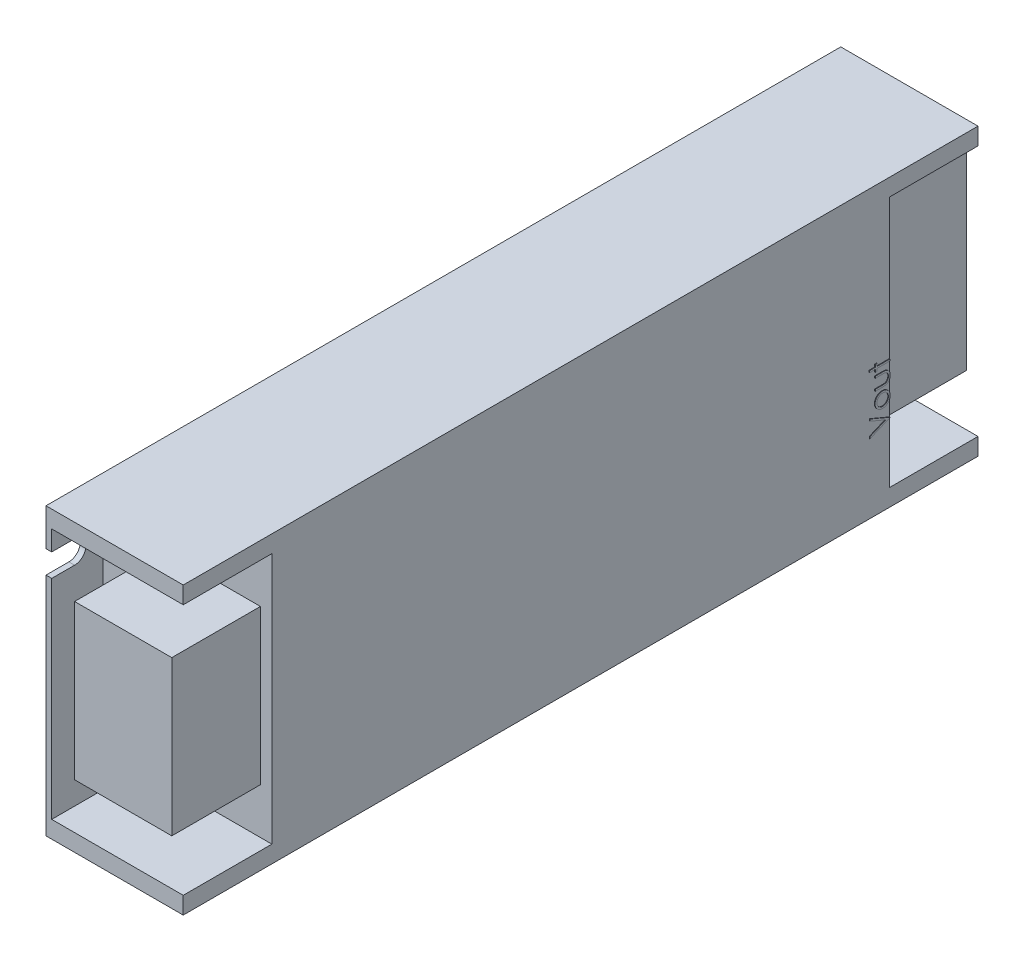
from build123d import *

# Parameters (mm, degrees)
SKICA1_W                 = 24
SKICA1_H                 = 50
P_IDAT_VYSUNUT_M1_DEPTH  = 139
SKICA2_W                 = 15.5
SKICA2_H                 = 44
ODEBRAT_VYSUNUT_M1_DEPTH = 19
SKICA4_W                 = 9
SKICA4_H                 = 44
ODEBRAT_VYSUNUT_M2_DEPTH = 4
SKICA5_W                 = 15.5
SKICA5_H                 = 27
SKICA5_H_2               = 35
P_IDAT_VYSUNUT_M2_DEPTH  = 17
P_IDAT_VYSUNUT_M3_DEPTH  = 0.1
ODEBRAT_VYSUNUT_M3_DEPTH = 10


with BuildPart() as part:
    # Skica1 → Přidat vysunutím1 (new body)
    with BuildSketch(Plane.XY):
        with Locations((12, 25)):
            Rectangle(SKICA1_W, SKICA1_H)
    extrude(amount=P_IDAT_VYSUNUT_M1_DEPTH)

    # Skica2 → Odebrat vysunutím1 (cut)
    with BuildSketch(Plane(origin=(24, 0, 0), x_dir=(0, 0, -1), z_dir=(1, 0, 0))):
        with Locations((-131.25, 25)):
            Rectangle(SKICA2_W, SKICA2_H)
        with Locations((-7.75, 25)):
            Rectangle(SKICA2_W, SKICA2_H)
    extrude(amount=-ODEBRAT_VYSUNUT_M1_DEPTH, mode=Mode.SUBTRACT)

    # Skica4 → Odebrat vysunutím2 (cut)
    with BuildSketch(Plane(origin=(5, 0, 0), x_dir=(0, 0, -1), z_dir=(1, 0, 0))):
        with Locations((-134.5, 25)):
            Rectangle(SKICA4_W, SKICA4_H)
        with Locations((-4.5, 25)):
            Rectangle(SKICA4_W, SKICA4_H)
    extrude(amount=-ODEBRAT_VYSUNUT_M2_DEPTH, mode=Mode.SUBTRACT)

    # Skica5 → Přidat vysunutím2 (add)
    with BuildSketch(Plane(origin=(5, 0, 0), x_dir=(0, 0, -1), z_dir=(1, 0, 0))):
        with Locations((-131.25, 24.5)):
            Rectangle(SKICA5_W, SKICA5_H)
        with Locations((-7.75, 29.5)):
            Rectangle(SKICA5_W, SKICA5_H_2)
    extrude(amount=P_IDAT_VYSUNUT_M2_DEPTH)

    # Skica6 → Přidat vysunutím3 (add)
    # profile 1 of 4: a face of its own
    with BuildSketch(Plane(origin=(24, 0, 0), x_dir=(0, 0, -1), z_dir=(1, 0, 0))):
        Polygon((-19, 12.179487179), (-19, 12.516025641), (-16.241786859, 13.682692308), (-19, 14.849358974), (-19, 15.185897436), (-15.5, 13.705128205), (-15.5, 13.66025641), align=None)
    # profile 2 of 4: a face of its own
    with BuildSketch(Plane(origin=(24, 0, 0), x_dir=(0, 0, -1), z_dir=(1, 0, 0))):
        with BuildLine():
            add(Edge.make_bspline(
                [(-18.102564103, 17.004607372), (-18.101542211, 17.052598645), (-18.099538533, 17.146697802), (-18.078123567, 17.284505688), (-18.045376203, 17.416050824), (-18.000104641, 17.541837016), (-17.93942269, 17.660253312), (-17.867013399, 17.773024556), (-17.781230805, 17.879841565), (-17.714872737, 17.943864594), (-17.681189904, 17.976362179)],
                knots=[0, 0, 0, 0, 1.054011418, 2.066658804, 3.057071809, 4.030435133, 4.997543892, 5.974964718, 6.972108034, 8, 8, 8, 8], degree=3))
            add(Edge.make_bspline(
                [(-17.681189904, 17.976362179), (-17.648975918, 18.004344134), (-17.585171376, 18.059766514), (-17.481715763, 18.130832233), (-17.374575662, 18.192053793), (-17.262328336, 18.241116754), (-17.145953664, 18.279801777), (-17.025051653, 18.307267474), (-16.899889306, 18.323604409), (-16.814885468, 18.325807376), (-16.771834936, 18.326923077)],
                knots=[0, 0, 0, 0, 1.025258237, 2.030674902, 3.01204498, 3.988269485, 4.97094183, 5.956517959, 6.965070386, 8, 8, 8, 8], degree=3))
            add(Edge.make_bspline(
                [(-16.771834936, 18.326923077), (-16.728534878, 18.32594174), (-16.642971945, 18.324002571), (-16.516952579, 18.305658955), (-16.394757756, 18.277127869), (-16.276899063, 18.236296031), (-16.163016235, 18.183937922), (-16.053606686, 18.120047234), (-15.948454553, 18.044175617), (-15.848452714, 17.95817162), (-15.7562865, 17.863119744), (-15.67595823, 17.760003596), (-15.607136706, 17.650849562), (-15.55170029, 17.534206209), (-15.50799059, 17.411138722), (-15.477290573, 17.281381654), (-15.45872889, 17.145136583), (-15.456345316, 17.052109362), (-15.455128205, 17.004607372)],
                knots=[0, 0, 0, 0, 0.998656419, 1.973391657, 2.932242238, 3.890759089, 4.846373663, 5.82037756, 6.809684879, 7.83454468, 8.860553229, 9.859544525, 10.845671541, 11.83227036, 12.833544569, 13.85385346, 14.904124723, 16, 16, 16, 16], degree=3))
            add(Edge.make_bspline(
                [(-15.455128205, 17.004607372), (-15.456349401, 16.956872652), (-15.458741176, 16.863381793), (-15.477218459, 16.726655811), (-15.507976441, 16.596666192), (-15.551843934, 16.473437593), (-15.607138478, 16.356292746), (-15.675750167, 16.246506249), (-15.756310322, 16.143306334), (-15.848446259, 16.048234349), (-15.948456216, 15.962235744), (-16.053606254, 15.886362736), (-16.163016348, 15.82247241), (-16.276899033, 15.770114206), (-16.394757764, 15.729282393), (-16.516952577, 15.7007513), (-16.642971945, 15.682407685), (-16.728534878, 15.680468517), (-16.771834936, 15.679487179)],
                knots=[0, 0, 0, 0, 1.099876186, 2.154163076, 3.173186993, 4.173200201, 5.163417411, 6.152872554, 7.150605724, 8.17532212, 9.198891216, 10.186952605, 11.159729845, 12.11414092, 13.071450619, 14.029093627, 15.002601286, 16, 16, 16, 16], degree=3))
            add(Edge.make_bspline(
                [(-16.771834936, 15.679487179), (-16.814652437, 15.680607821), (-16.899423731, 15.682826499), (-17.02433693, 15.699185729), (-17.144868911, 15.726352577), (-17.260608083, 15.765573886), (-17.372585626, 15.814545771), (-17.48011856, 15.875151162), (-17.583122115, 15.946904323), (-17.646842045, 16.002111388), (-17.679086538, 16.030048077)],
                knots=[0, 0, 0, 0, 1.031377469, 2.041950136, 3.029500481, 4.003457997, 4.981637986, 5.969878303, 6.97268806, 8, 8, 8, 8], degree=3))
            add(Edge.make_bspline(
                [(-17.679086538, 16.030048077), (-17.713061478, 16.062496668), (-17.779879174, 16.126312532), (-17.865411698, 16.23366126), (-17.939327772, 16.346155081), (-17.998803987, 16.465880007), (-18.045642505, 16.591562865), (-18.07820802, 16.723782107), (-18.099461375, 16.862057623), (-18.101519553, 16.956617244), (-18.102564103, 17.004607372)],
                knots=[0, 0, 0, 0, 1.027980169, 2.021703884, 2.998553061, 3.971491411, 4.943284454, 5.930300938, 6.949603206, 8, 8, 8, 8], degree=3))
        make_face()
        with BuildLine():
            add(Edge.make_bspline(
                [(-17.788461538, 17.003205128), (-17.787496947, 16.969267517), (-17.785592664, 16.902268388), (-17.771108759, 16.803648804), (-17.748161257, 16.708708647), (-17.715557194, 16.617267816), (-17.673458319, 16.529634591), (-17.621749868, 16.445725389), (-17.561117263, 16.365292174), (-17.49165323, 16.289913113), (-17.415779287, 16.22071966), (-17.334912684, 16.160281923), (-17.250292131, 16.108601148), (-17.16179029, 16.066329343), (-17.069105401, 16.03390987), (-16.97278329, 16.010936816), (-16.872533096, 15.99642639), (-16.804369985, 15.994545536), (-16.769731571, 15.993589744)],
                knots=[0, 0, 0, 0, 1.02155314, 2.01673505, 2.994700672, 3.958461264, 4.934171024, 5.916582427, 6.921469794, 7.962398674, 8.998583302, 10.009097305, 10.997513862, 11.97957236, 12.956600784, 13.948243505, 14.957359924, 16, 16, 16, 16], degree=3))
            add(Edge.make_bspline(
                [(-16.769731571, 15.993589744), (-16.724979543, 15.995196567), (-16.636155138, 15.998385812), (-16.505344015, 16.024321048), (-16.379762163, 16.067707328), (-16.260145777, 16.126294608), (-16.149473499, 16.199700826), (-16.050802015, 16.286187893), (-15.965616203, 16.384827593), (-15.894935358, 16.494444094), (-15.838775602, 16.612798412), (-15.798976626, 16.738054733), (-15.773104934, 16.868695427), (-15.770533459, 16.957976158), (-15.769230769, 17.003205128)],
                knots=[0, 0, 0, 0, 1.016792936, 2.018143844, 3.017858371, 4.030088057, 5.03801393, 6.028138512, 7.003788237, 7.991172063, 8.984598303, 9.972568034, 10.972917682, 12, 12, 12, 12], degree=3))
            add(Edge.make_bspline(
                [(-15.769230769, 17.003205128), (-15.770541049, 17.048431497), (-15.773127506, 17.137707093), (-15.798846326, 17.26816627), (-15.838949987, 17.393080242), (-15.894872197, 17.511311629), (-15.965884611, 17.620878233), (-16.050320988, 17.720227354), (-16.14973484, 17.805975965), (-16.260292369, 17.87930957), (-16.379576721, 17.938856313), (-16.505367193, 17.982039515), (-16.636149235, 18.008037101), (-16.724977566, 18.011217929), (-16.769731571, 18.012820513)],
                knots=[0, 0, 0, 0, 1.02726834, 2.027799167, 3.010890988, 4.004497153, 4.992059811, 5.971914811, 6.958719428, 7.966827853, 8.981595046, 9.981490638, 10.983022906, 12, 12, 12, 12], degree=3))
            add(Edge.make_bspline(
                [(-16.769731571, 18.012820513), (-16.804370192, 18.01186505), (-16.87253371, 18.009984845), (-16.972780943, 17.9954697), (-17.069113987, 17.972514072), (-17.161758671, 17.940030517), (-17.250521749, 17.897946481), (-17.334664636, 17.845272203), (-17.416059349, 17.785081319), (-17.491407949, 17.71505306), (-17.56114434, 17.639752675), (-17.62177338, 17.559286865), (-17.673231066, 17.475502086), (-17.715917283, 17.388123451), (-17.747864629, 17.296670897), (-17.771241259, 17.201863764), (-17.785531456, 17.103664955), (-17.787478598, 17.036905912), (-17.788461538, 17.003205128)],
                knots=[0, 0, 0, 0, 1.042975879, 2.052417305, 3.044379404, 4.0217225, 5.00409729, 5.996508862, 7.007348322, 8.048612455, 9.089876587, 10.095087598, 11.077815406, 12.047498138, 13.018202342, 13.98964644, 14.985148868, 16, 16, 16, 16], degree=3))
        make_face(mode=Mode.SUBTRACT)
    # profile 3 of 4: a face of its own
    with BuildSketch(Plane(origin=(24, 0, 0), x_dir=(0, 0, -1), z_dir=(1, 0, 0))):
        with BuildLine():
            Line((-18.057692308, 18.91025641), (-18.057692308, 19.224358974))
            Line((-18.057692308, 19.224358974), (-16.871394231, 19.224358974))
            add(Edge.make_bspline(
                [(-16.871394231, 19.224358974), (-16.836571482, 19.224500879), (-16.769957194, 19.224772337), (-16.674102007, 19.226613278), (-16.586685294, 19.230943371), (-16.507656557, 19.236357196), (-16.437029166, 19.243319332), (-16.375049809, 19.251602692), (-16.321015625, 19.260861114), (-16.288472269, 19.269923828), (-16.27333734, 19.274138622)],
                knots=[0, 0, 0, 0, 1.388932606, 2.656963016, 3.823490214, 4.879454478, 5.816252168, 6.653371382, 7.373723809, 8, 8, 8, 8], degree=3))
            add(Edge.make_bspline(
                [(-16.27333734, 19.274138622), (-16.254314469, 19.280900077), (-16.216664208, 19.294282418), (-16.162275202, 19.318555902), (-16.11189992, 19.348584238), (-16.063595847, 19.381444066), (-16.01879386, 19.419343474), (-15.977569617, 19.461802945), (-15.938365526, 19.507401182), (-15.891980734, 19.575156205), (-15.842265403, 19.667815471), (-15.799369585, 19.789468226), (-15.773733765, 19.921372452), (-15.77075951, 20.012537172), (-15.769230769, 20.059395032)],
                knots=[0, 0, 0, 0, 0.725840625, 1.436591201, 2.137033971, 2.831655856, 3.53531722, 4.242432219, 4.957935707, 5.694543706, 7.190802206, 8.724350549, 10.316345118, 12, 12, 12, 12], degree=3))
            add(Edge.make_bspline(
                [(-15.769230769, 20.059395032), (-15.770792018, 20.10624854), (-15.773812745, 20.196901408), (-15.798596284, 20.327356377), (-15.840001973, 20.446607792), (-15.897809384, 20.553458743), (-15.968551447, 20.647424583), (-16.051560256, 20.725729002), (-16.144209643, 20.790336257), (-16.213333922, 20.818545677), (-16.248096955, 20.832732372)],
                knots=[0, 0, 0, 0, 1.157059328, 2.238695713, 3.266970494, 4.264342957, 5.228770407, 6.160125903, 7.074715775, 8, 8, 8, 8], degree=3))
            add(Edge.make_bspline(
                [(-16.248096955, 20.832732372), (-16.262063254, 20.836926602), (-16.292939329, 20.84619902), (-16.345319078, 20.856161372), (-16.407783682, 20.865135833), (-16.480741891, 20.872799009), (-16.564003043, 20.878264172), (-16.657541119, 20.881210199), (-16.76106248, 20.884538474), (-16.833530239, 20.88458899), (-16.871394231, 20.884615385)],
                knots=[0, 0, 0, 0, 0.557542046, 1.232589297, 2.036731608, 2.971723315, 4.038036528, 5.22795436, 6.551621927, 8, 8, 8, 8], degree=3))
            Line((-16.871394231, 20.884615385), (-18.057692308, 20.884615385))
            Line((-18.057692308, 20.884615385), (-18.057692308, 21.198717949))
            Line((-18.057692308, 21.198717949), (-16.8125, 21.198717949))
            add(Edge.make_bspline(
                [(-16.8125, 21.198717949), (-16.770193064, 21.198274667), (-16.688111822, 21.197414639), (-16.568824502, 21.191928884), (-16.457442487, 21.182385289), (-16.354306526, 21.168273872), (-16.259392664, 21.151154011), (-16.172668679, 21.129508363), (-16.094021821, 21.103516658), (-16.022278152, 21.074215578), (-15.957236046, 21.03958845), (-15.895483334, 21.00277788), (-15.838652658, 20.960193059), (-15.783669926, 20.91574862), (-15.734378406, 20.865147037), (-15.686871763, 20.812281066), (-15.644191351, 20.754244055), (-15.604921928, 20.692720605), (-15.569707159, 20.627131235), (-15.538720643, 20.557635532), (-15.512916197, 20.483953539), (-15.491884563, 20.406112469), (-15.475085037, 20.324415071), (-15.463322437, 20.238695659), (-15.456090453, 20.149031341), (-15.45545434, 20.087921559), (-15.455128205, 20.056590545)],
                knots=[0, 0, 0, 0, 1.493202592, 2.897017285, 4.213619731, 5.437335819, 6.569830554, 7.616136122, 8.589086983, 9.491357706, 10.347307, 11.187612773, 12.025729508, 12.851620453, 13.679855991, 14.515574443, 15.358588344, 16.218977568, 17.089938093, 17.983570823, 18.901874366, 19.842360053, 20.827541903, 21.843594624, 22.894409941, 24, 24, 24, 24], degree=3))
            add(Edge.make_bspline(
                [(-15.455128205, 20.056590545), (-15.455467437, 20.025493865), (-15.456134059, 19.964385995), (-15.463282592, 19.874717093), (-15.475066635, 19.788760082), (-15.492007555, 19.706869536), (-15.51276337, 19.628715389), (-15.538879827, 19.554677072), (-15.569703446, 19.484661091), (-15.604768555, 19.4185168), (-15.644263669, 19.356463646), (-15.687732462, 19.298641102), (-15.734040785, 19.244018341), (-15.784767972, 19.194111618), (-15.839534233, 19.14855489), (-15.898093467, 19.107150654), (-15.95978383, 19.069190732), (-16.025848019, 19.034838828), (-16.098419733, 19.005326817), (-16.178716919, 18.979271648), (-16.267619409, 18.957960987), (-16.365051346, 18.940618525), (-16.470546385, 18.926667083), (-16.584714801, 18.916980941), (-16.707278493, 18.91156511), (-16.791928383, 18.910702049), (-16.835637019, 18.91025641)],
                knots=[0, 0, 0, 0, 1.083759936, 2.129689164, 3.133164553, 4.10615121, 5.04285688, 5.949793092, 6.839814394, 7.707177441, 8.556916231, 9.400895077, 10.227072161, 11.05083587, 11.877976332, 12.707560346, 13.548664154, 14.401248865, 15.299878211, 16.27626931, 17.341250723, 18.483766318, 19.724630785, 21.049282549, 22.476408703, 24, 24, 24, 24], degree=3))
            Line((-16.835637019, 18.91025641), (-18.057692308, 18.91025641))
        make_face()
    # profile 4 of 4: a face of its own
    with BuildSketch(Plane(origin=(24, 0, 0), x_dir=(0, 0, -1), z_dir=(1, 0, 0))):
        Polygon((-19.08974359, 22.230769231), (-19.08974359, 22.544871795), (-18.057692308, 22.544871795), (-18.057692308, 22.993589744), (-17.743589744, 22.993589744), (-17.743589744, 22.544871795), (-15.5, 22.544871795), (-15.5, 22.230769231), (-17.743589744, 22.230769231), (-17.743589744, 21.782051282), (-18.057692308, 21.782051282), (-18.057692308, 22.230769231), align=None)
    extrude(amount=P_IDAT_VYSUNUT_M3_DEPTH)

    # Skica7 → Odebrat vysunutím3 (cut)
    with BuildSketch(Plane(origin=(1, 0, 0), x_dir=(0, 0, -1), z_dir=(1, 0, 0))):
        with BuildLine():
            Line((-139, 43.5), (-135, 43.5))
            ThreePointArc((-135, 43.5), (-133, 41.5), (-135, 39.5))
            Line((-135, 39.5), (-139, 39.5))
            ThreePointArc((-139, 39.5), (-141, 41.5), (-139, 43.5))
        make_face()
        with BuildLine():
            Line((0, 6.5), (-4, 6.5))
            ThreePointArc((-4, 6.5), (-6, 8.5), (-4, 10.5))
            Line((-4, 10.5), (0, 10.5))
            ThreePointArc((0, 10.5), (2, 8.5), (0, 6.5))
        make_face()
    extrude(amount=-ODEBRAT_VYSUNUT_M3_DEPTH, mode=Mode.SUBTRACT)


solid = part.part
